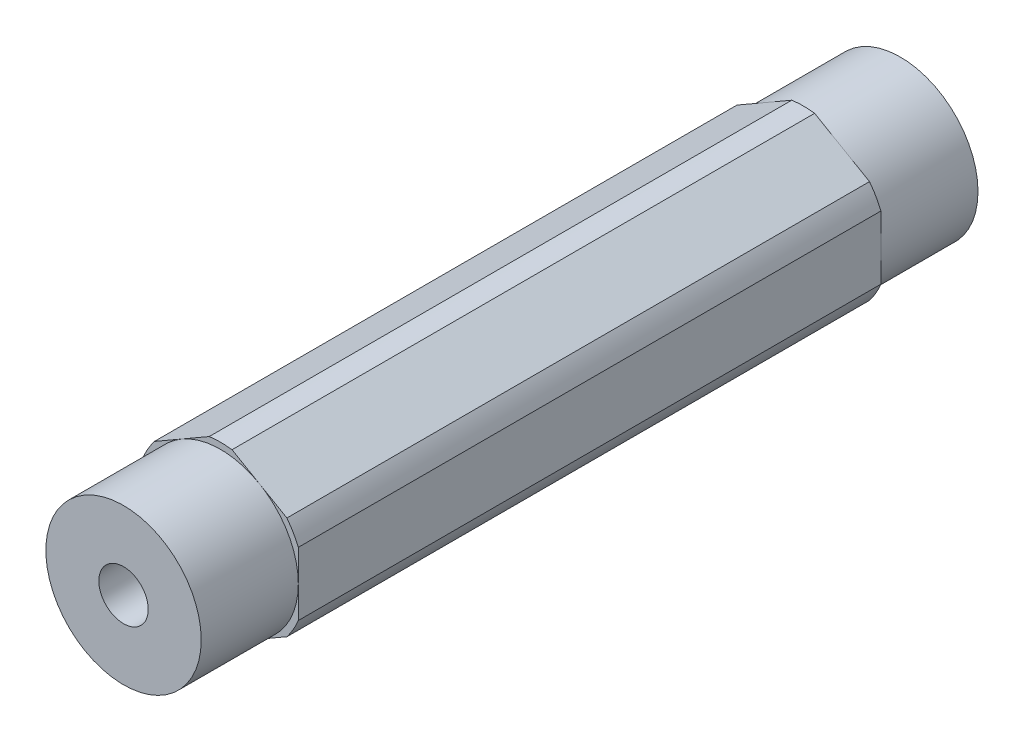
from build123d import *

# Parameters (mm, degrees)
BOSS_EXTRUDE1_DEPTH                  = 31.75
CUT_EXTRUDE1_START                   = 31.75
SKETCH2_OUTSIDE_W                    = 27.938
SKETCH2_OUTSIDE_H                    = 28.954
SKETCH2_OUTSIDE_R                    = 6.35
CUT_EXTRUDE1_DEPTH                   = 7.9375
SKETCH5_OUTSIDE_W                    = 27.938
SKETCH5_OUTSIDE_H                    = 28.954
SKETCH5_OUTSIDE_R                    = 6.35
CUT_EXTRUDE5_DEPTH                   = 7.9375
F_10_32_TAPPED_HOLE1_D               = 4.0386
F_10_32_TAPPED_HOLE1_DEPTH           = 12.02944
F_10_32_TAPPED_HOLE1_TIP             = 1.213317848
F_10_32_TAPPED_HOLE1_ON_FACE_2_D     = 4.0386
F_10_32_TAPPED_HOLE1_ON_FACE_2_DEPTH = 12.02944
F_10_32_TAPPED_HOLE1_ON_FACE_2_TIP   = 1.213317848


with BuildPart() as part:
    # Sketch1 → Boss-Extrude1 (new, symmetric)
    with BuildSketch(Plane.XY):
        with BuildLine():
            ThreePointArc((0.93173274, 6.79441227), (0, 6.858), (-0.93173274, 6.79441227))
            Line((-0.93173274, 6.79441227), (-5.41826726, 4.204110358))
            ThreePointArc((-5.41826726, 4.204110358), (-5.939202219, 3.429), (-6.35, 2.590301913))
            Line((-6.35, 2.590301913), (-6.35, -2.590301913))
            ThreePointArc((-6.35, -2.590301913), (-5.939202219, -3.429), (-5.41826726, -4.204110358))
            Line((-5.41826726, -4.204110358), (-0.93173274, -6.79441227))
            ThreePointArc((-0.93173274, -6.79441227), (0, -6.858), (0.93173274, -6.79441227))
            Line((0.93173274, -6.79441227), (5.41826726, -4.204110358))
            ThreePointArc((5.41826726, -4.204110358), (5.939202219, -3.429), (6.35, -2.590301913))
            Line((6.35, -2.590301913), (6.35, 2.590301913))
            ThreePointArc((6.35, 2.590301913), (5.939202219, 3.429), (5.41826726, 4.204110358))
            Line((5.41826726, 4.204110358), (0.93173274, 6.79441227))
        make_face()
    extrude(amount=BOSS_EXTRUDE1_DEPTH, both=True)

    # Sketch2 outside → Cut-Extrude1 (cut)
    with BuildSketch(Plane.XY.offset(CUT_EXTRUDE1_START)):
        Rectangle(SKETCH2_OUTSIDE_W, SKETCH2_OUTSIDE_H)
        Circle(SKETCH2_OUTSIDE_R, mode=Mode.SUBTRACT)
    extrude(amount=-CUT_EXTRUDE1_DEPTH, mode=Mode.SUBTRACT)

    # Sketch5 outside → Cut-Extrude5 (cut)
    with BuildSketch(Plane(origin=(0, 0, -31.75), x_dir=(-1, 0, 0), z_dir=(0, 0, -1))):
        Rectangle(SKETCH5_OUTSIDE_W, SKETCH5_OUTSIDE_H)
        with Locations(Location((0, 0, 0), (0, 0, 180))):
            Circle(SKETCH5_OUTSIDE_R, mode=Mode.SUBTRACT)
    extrude(amount=-CUT_EXTRUDE5_DEPTH, mode=Mode.SUBTRACT)

    # #10-32 Tapped Hole1
    with Locations(Plane(origin=(0, 0, -31.75), x_dir=(-1, 0, 0), z_dir=(0, 0, -1))):
        with Locations((0, 0)):
            Hole(F_10_32_TAPPED_HOLE1_D / 2, depth=F_10_32_TAPPED_HOLE1_DEPTH)
            with Locations((0, 0, -(F_10_32_TAPPED_HOLE1_DEPTH + F_10_32_TAPPED_HOLE1_TIP / 2))):  # 118° drill point
                Cone(0, F_10_32_TAPPED_HOLE1_D / 2, F_10_32_TAPPED_HOLE1_TIP, mode=Mode.SUBTRACT)

    # #10-32 Tapped Hole1 on face 2
    with Locations(Plane.XY.offset(31.75)):
        with Locations((0, 0)):
            Hole(F_10_32_TAPPED_HOLE1_ON_FACE_2_D / 2, depth=F_10_32_TAPPED_HOLE1_ON_FACE_2_DEPTH)
            with Locations((0, 0, -(F_10_32_TAPPED_HOLE1_ON_FACE_2_DEPTH + F_10_32_TAPPED_HOLE1_ON_FACE_2_TIP / 2))):  # 118° drill point
                Cone(0, F_10_32_TAPPED_HOLE1_ON_FACE_2_D / 2, F_10_32_TAPPED_HOLE1_ON_FACE_2_TIP, mode=Mode.SUBTRACT)


solid = part.part
